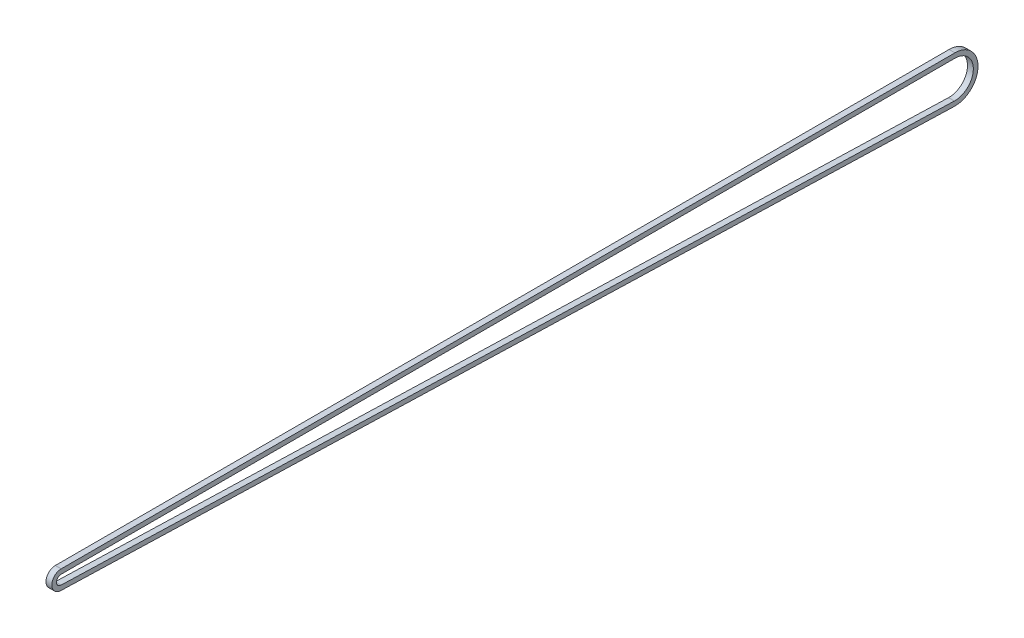
from build123d import *

# Parameters (mm, degrees)
EXTRUDE_1_DEPTH = 5


with BuildPart() as part:
    # ｽｹｯﾁ1 → ﾎﾞｽ - 押し出し1 (new body)
    with BuildSketch(Plane(origin=(0, 0, 0), x_dir=(0, 0, -1), z_dir=(1, 0, 0))):
        with BuildLine():
            Line((765.52, 8), (0, 8))
            ThreePointArc((0, 8), (-7.999057794, 0.122777888), (-0.245526856, -7.996231398))
            Line((-0.245526856, -7.996231398), (764.913855574, -31.490696263))
            ThreePointArc((764.913855574, -31.490696263), (785.267673929, -12.053107912), (765.52, 8))
        make_face()
        with BuildLine():
            ThreePointArc((-0.122763428, -3.998115699), (-3.999528897, 0.061388944), (0, 4))
            Line((0, 4), (765.52, 4))
            ThreePointArc((765.52, 4), (776.656931804, -0.613068196), (781.27, -11.75))
            ThreePointArc((781.27, -11.75), (776.484699022, -23.056541264), (765.036619002, -27.492580564))
            Line((765.036619002, -27.492580564), (-0.122763428, -3.998115699))
        make_face(mode=Mode.SUBTRACT)
    extrude(amount=EXTRUDE_1_DEPTH)


solid = part.part
